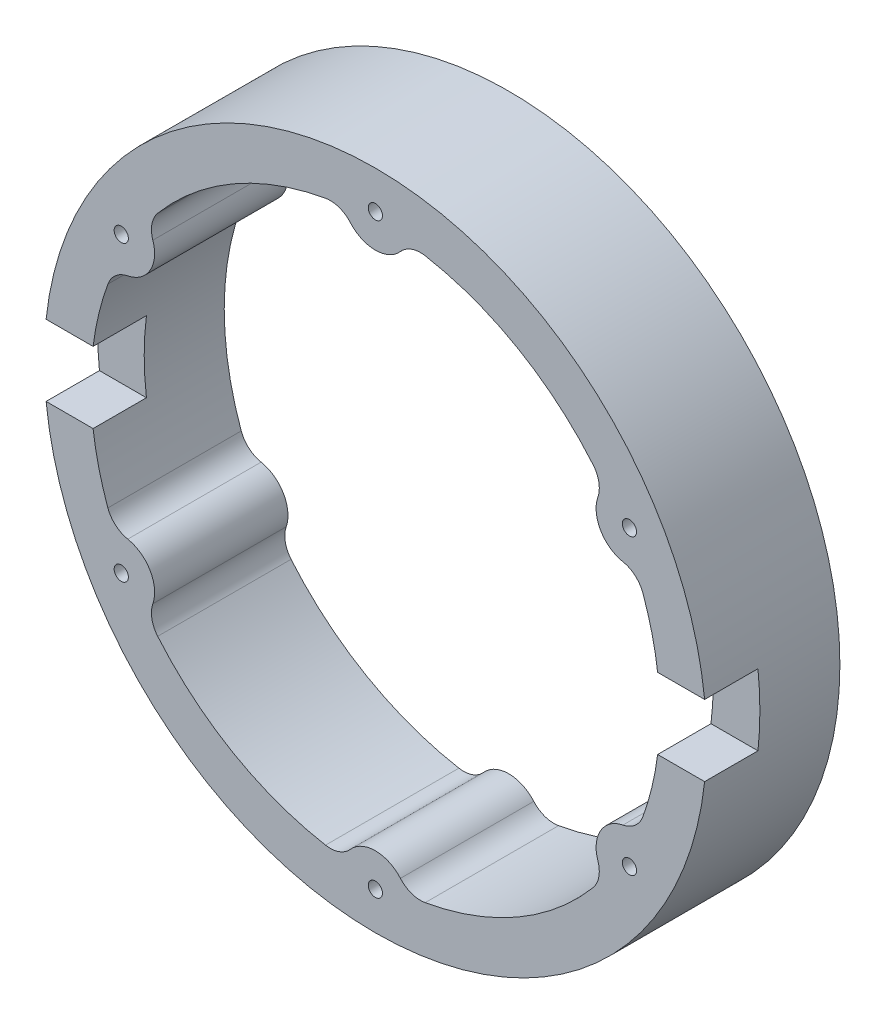
from build123d import *

# Parameters (mm, degrees)
ESQUISSE1_R                  = 74.5
BOSS_EXTRU_1_DEPTH           = 30
ESQUISSE3_R                  = 64
ENL_V_MAT_EXTRU_1_DEPTH      = 110.546793655
BOSS_EXTRU_2_DEPTH           = 30
ESQUISSE5_R                  = 1.6
ENL_V_MAT_EXTRU_2_DEPTH      = 120
R_P_TITION_CIRCULAIRE1_COUNT = 6
ENL_V_MAT_EXTRU_3_DEPTH      = 110.546793655
ENL_V_MAT_EXTRU_3_DEPTH_BACK = 110.546793655
ESQUISSE7_W                  = 12
ESQUISSE7_H                  = 16


with BuildPart() as part:
    # Esquisse1 → Boss.-Extru.1 (new body)
    with BuildSketch(Plane.XY):
        Circle(ESQUISSE1_R)
    extrude(amount=BOSS_EXTRU_1_DEPTH)

    # Esquisse3 → Enlèv. mat.-Extru.1 (cut, through all)
    with BuildSketch(Plane(origin=(0, 0, 0), x_dir=(-1, 0, 0), z_dir=(0, 0, -1))):
        Circle(ESQUISSE3_R)
    extrude(amount=-ENL_V_MAT_EXTRU_1_DEPTH, mode=Mode.SUBTRACT)

    # Esquisse4 → Boss.-Extru.2 (add)
    with BuildSketch(Plane(origin=(0, 0, 0), x_dir=(-1, 0, 0), z_dir=(0, 0, -1))):
        with BuildLine():
            ThreePointArc((-11.204980679, 63.011494253), (-8.166638415, 62.765293029), (-5.641396522, 61.05787037))
            ThreePointArc((-5.641396522, 61.05787037), (-3.097097656, 59.169334871), (0, 58.5))
            ThreePointArc((0, 58.5), (3.097097656, 59.169334871), (5.641396522, 61.05787037))
            ThreePointArc((5.641396522, 61.05787037), (8.166638415, 62.765293029), (11.204980679, 63.011494253))
            ThreePointArc((11.204980679, 63.011494253), (0, 64), (-11.204980679, 63.011494253))
        make_face()
    boss_extru_2 = extrude(amount=-BOSS_EXTRU_2_DEPTH)

    # Esquisse5 → Enlèv. mat.-Extru.2 (cut)
    with BuildSketch(Plane(origin=(0, 0, 0), x_dir=(-1, 0, 0), z_dir=(0, 0, -1))):
        with Locations((0, 66)):
            Circle(ESQUISSE5_R)
    enl_v_mat_extru_2 = extrude(amount=-ENL_V_MAT_EXTRU_2_DEPTH, mode=Mode.SUBTRACT)

    # Répétition circulaire1: Boss.-Extru.2, Enlèv. mat.-Extru.2 ×6 about axis
    r_p_tition_circulaire1_axis = Axis((0, 0, 0), (0, 0, 1))
    add([boss_extru_2.rotate(r_p_tition_circulaire1_axis, i * 360 / R_P_TITION_CIRCULAIRE1_COUNT) for i in range(1, R_P_TITION_CIRCULAIRE1_COUNT)])
    add([enl_v_mat_extru_2.rotate(r_p_tition_circulaire1_axis, i * 360 / R_P_TITION_CIRCULAIRE1_COUNT) for i in range(1, R_P_TITION_CIRCULAIRE1_COUNT)], mode=Mode.SUBTRACT)

    # Esquisse7 → Enlèv. mat.-Extru.3 (cut, two sides: drawn at the far end of the back side and taken through both)
    with BuildSketch(Plane(origin=(0, 0, 0), x_dir=(0, 0, -1), z_dir=(1, 0, 0)).offset(-ENL_V_MAT_EXTRU_3_DEPTH_BACK)):
        with Locations((-24, 0)):
            Rectangle(ESQUISSE7_W, ESQUISSE7_H)
    extrude(amount=ENL_V_MAT_EXTRU_3_DEPTH + ENL_V_MAT_EXTRU_3_DEPTH_BACK, mode=Mode.SUBTRACT)


solid = part.part
